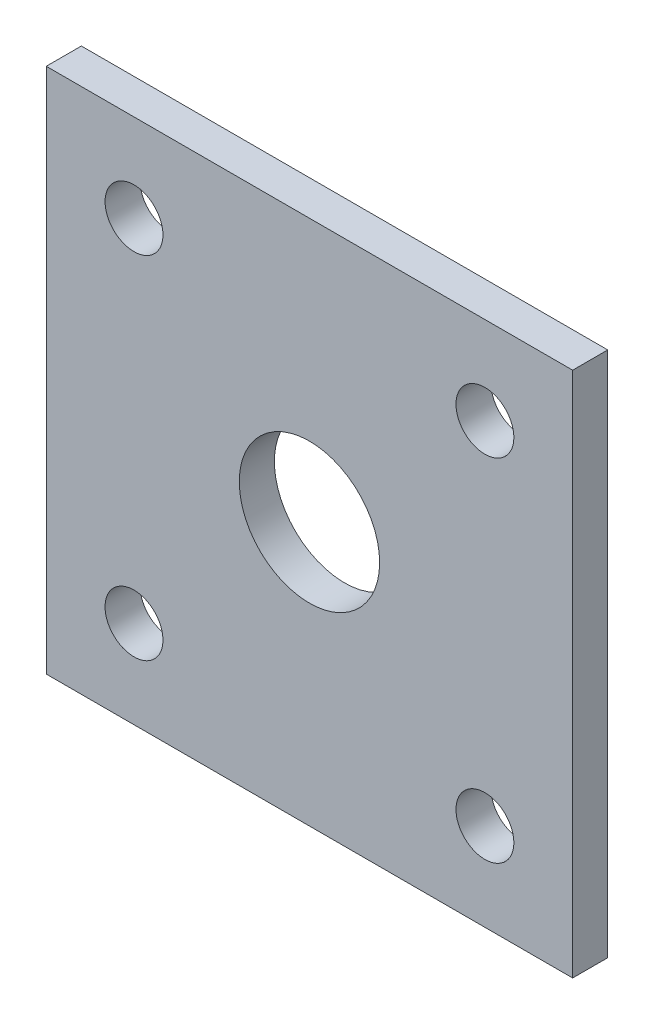
from build123d import *

# Parameters (mm, degrees)
ESQUISSE1_W        = 30
ESQUISSE1_H        = 30
ESQUISSE1_R        = 1.65
ESQUISSE1_R_2      = 4
BOSS_EXTRU_1_DEPTH = 2


with BuildPart() as part:
    # Esquisse1 → Boss.-Extru.1 (new body)
    with BuildSketch(Plane.XY):
        with Locations((-31.291344469, 14.542559553)):
            Rectangle(ESQUISSE1_W, ESQUISSE1_H)
        with Locations((-41.291344469, 24.542559553)):
            Circle(ESQUISSE1_R, mode=Mode.SUBTRACT)
        with Locations((-21.291344469, 24.542559553)):
            Circle(ESQUISSE1_R, mode=Mode.SUBTRACT)
        with Locations((-21.291344469, 4.542559553)):
            Circle(ESQUISSE1_R, mode=Mode.SUBTRACT)
        with Locations((-41.291344469, 4.542559553)):
            Circle(ESQUISSE1_R, mode=Mode.SUBTRACT)
        with Locations((-31.291344469, 14.542559553)):
            Circle(ESQUISSE1_R_2, mode=Mode.SUBTRACT)
    extrude(amount=BOSS_EXTRU_1_DEPTH)


solid = part.part
